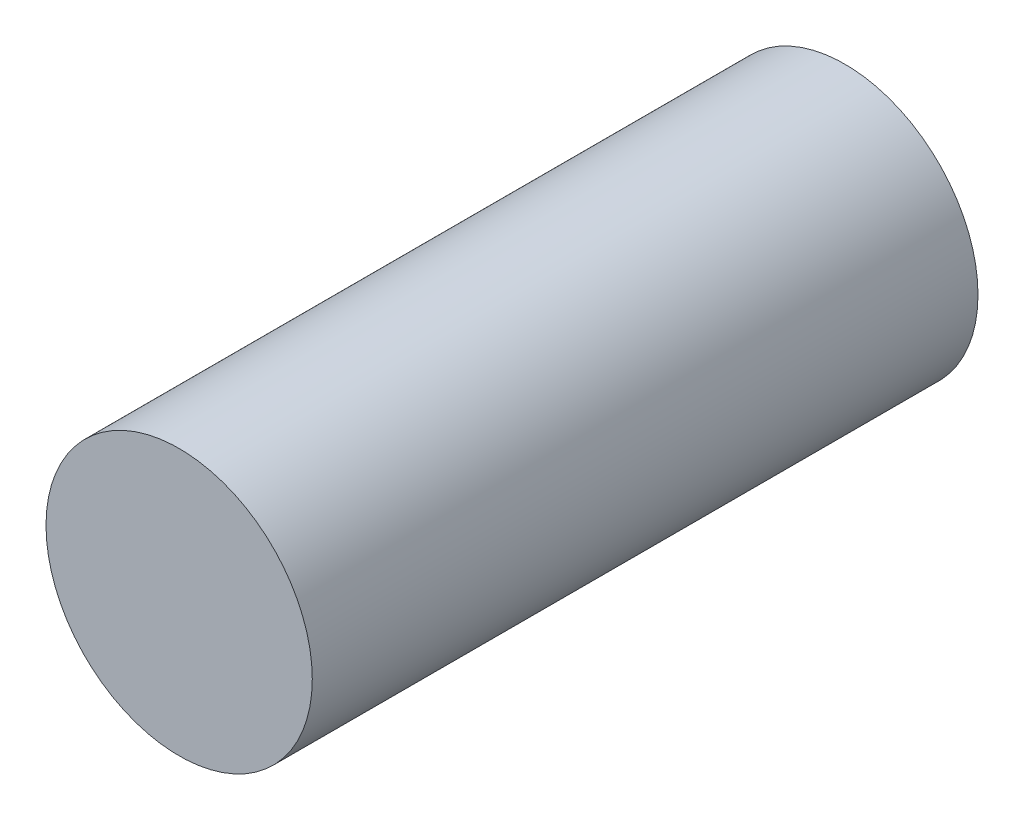
from build123d import *

# Parameters (mm, degrees)
SKETCH1_R           = 4
BOSS_EXTRUDE1_DEPTH = 20


with BuildPart() as part:
    # Sketch1 → Boss-Extrude1 (new body)
    with BuildSketch(Plane.XY):
        with Locations((-16.359309846, 0)):
            Circle(SKETCH1_R)
    extrude(amount=BOSS_EXTRUDE1_DEPTH)


solid = part.part
